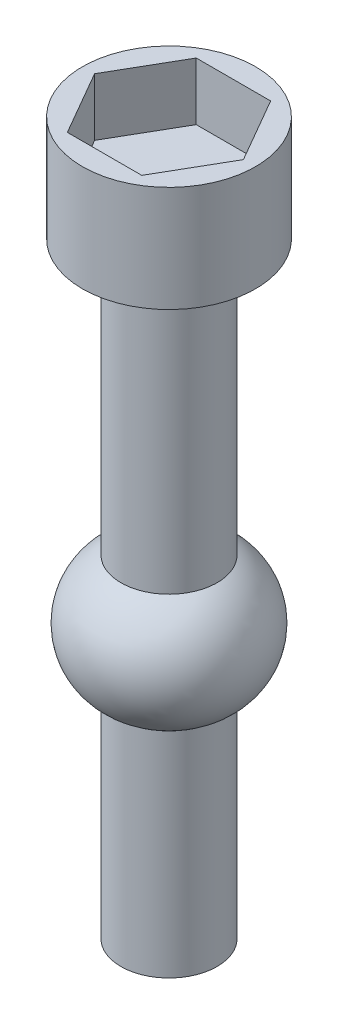
from build123d import *

# Parameters (mm, degrees)
SKETCH1_R           = 1.25
BOSS_EXTRUDE1_DEPTH = 18.5
SKETCH2_R           = 2.25
BOSS_EXTRUDE2_DEPTH = 2.75
CUT_EXTRUDE1_DEPTH  = 1.5


with BuildPart() as part:
    # Sketch1 → Boss-Extrude1 (new body)
    with BuildSketch(Plane(origin=(0, 0, 0), x_dir=(1, 0, 0), z_dir=(0, 1, 0))):
        with Locations(Location((0, 0, 0), (0, 0, 270))):
            Circle(SKETCH1_R)
    extrude(amount=BOSS_EXTRUDE1_DEPTH)

    # Sketch2 → Boss-Extrude2 (add)
    with BuildSketch(Plane(origin=(0, 18.5, 0), x_dir=(1, 0, 0), z_dir=(0, 1, 0))):
        with Locations(Location((0, 0, 0), (0, 0, 270))):
            Circle(SKETCH2_R)
    extrude(amount=-BOSS_EXTRUDE2_DEPTH)

    # Sketch4 → Revolve1 (revolve)
    with BuildSketch(Plane.XY, mode=Mode.PRIVATE) as revolve1_sk:
        with BuildLine():
            Line((1.25, 8.636562631), (1.25, 5.576897201))
            ThreePointArc((1.25, 5.576897201), (2.168320153, 7.106729916), (1.25, 8.636562631))
        make_face()
    revolve(revolve1_sk.sketch.rotate(Axis((0, 0, 0), (0, 1, 0)), 90), axis=Axis((0, 0, 0), (0, 1, 0)))

    # Sketch5 → Cut-Extrude1 (cut)
    with BuildSketch(Plane(origin=(0, 18.5, 0), x_dir=(1, 0, 0), z_dir=(0, 1, 0))):
        Polygon((0.966659902, 1.674304064), (-0.966659902, 1.674304064), (-1.933319804, 0), (-0.966659902, -1.674304064), (0.966659902, -1.674304064), (1.933319804, 0), align=None)
    extrude(amount=-CUT_EXTRUDE1_DEPTH, mode=Mode.SUBTRACT)


solid = part.part
